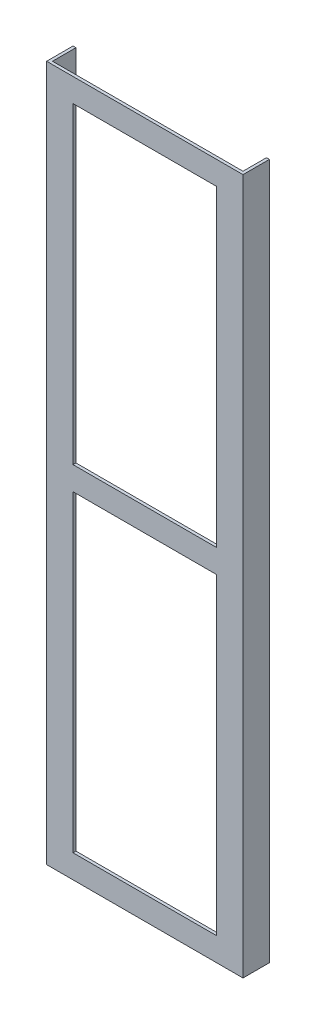
from build123d import *

# Parameters (mm, degrees)
SKETCH1_W                      = 103.175
SKETCH1_H                      = 103.175
SKETCH1_W_2                    = 100
SKETCH1_H_2                    = 100
BULKSHELLEXTRUDE_DEPTH         = 376.8
SKETCH14_W                     = 77.775
SKETCH14_H                     = 351.4
SIDEWALLCUT_DEPTH              = 103.1875
SIDEWALLCUTPATTERN_COUNT       = 4
SKETCH20_W                     = 77.775
SKETCH20_H                     = 12.7
CENTERSUPPORT_DEPTH            = 1.5875
CENTERSUPPORTPATTERNCIRC_COUNT = 4
SKETCH22_W                     = 100
SKETCH22_H                     = 376.8
CUT_EXTRUDE4_DEPTH             = 103.1875
SKETCH23_W                     = 1.5875
SKETCH23_H                     = 376.8
BOSS_EXTRUDE1_DEPTH            = 1.5875
SKETCH24_W                     = 1.5875
SKETCH24_H                     = 376.8
BOSS_EXTRUDE2_DEPTH            = 12.7


with BuildPart() as part:
    # Sketch1 → BulkShellExtrude (new body)
    with BuildSketch(Plane(origin=(0, 0, 0), x_dir=(1, 0, 0), z_dir=(0, 1, 0))):
        Rectangle(SKETCH1_W, SKETCH1_H)
        Rectangle(SKETCH1_W_2, SKETCH1_H_2, mode=Mode.SUBTRACT)
    extrude(amount=BULKSHELLEXTRUDE_DEPTH)

    # Sketch14 → SideWallCut (cut)
    with BuildSketch(Plane(origin=(51.5875, 0, 0), x_dir=(0, 0, -1), z_dir=(1, 0, 0))):
        with Locations((0, 188.4)):
            Rectangle(SKETCH14_W, SKETCH14_H)
    sidewallcut = extrude(amount=-SIDEWALLCUT_DEPTH, mode=Mode.SUBTRACT)

    # SideWallCutPattern: SideWallCut ×4 about axis
    sidewallcutpattern_axis = Axis((0, 0, 0), (0, 1, 0))
    for i in range(1, SIDEWALLCUTPATTERN_COUNT):
        add(sidewallcut.rotate(sidewallcutpattern_axis, i * 360 / SIDEWALLCUTPATTERN_COUNT), mode=Mode.SUBTRACT)

    # Sketch20 → CenterSupport (add)
    with BuildSketch(Plane.XY.offset(51.5875)):
        with Locations((0, 188.4)):
            Rectangle(SKETCH20_W, SKETCH20_H)
    centersupport = extrude(amount=-CENTERSUPPORT_DEPTH)

    # CenterSupportPatternCirc: CenterSupport ×4 about axis
    centersupportpatterncirc_axis = Axis((0, 0, 0), (0, 1, 0))
    for i in range(1, CENTERSUPPORTPATTERNCIRC_COUNT):
        add(centersupport.rotate(centersupportpatterncirc_axis, i * 360 / CENTERSUPPORTPATTERNCIRC_COUNT))

    # Sketch22 → Cut-Extrude4 (cut)
    with BuildSketch(Plane(origin=(51.5875, 0, 0), x_dir=(0, 0, -1), z_dir=(1, 0, 0))):
        with Locations((0, 188.4)):
            Rectangle(SKETCH22_W, SKETCH22_H)
    extrude(amount=-CUT_EXTRUDE4_DEPTH, mode=Mode.SUBTRACT)


with BuildPart() as body_2:
    # of the pieces the cut leaves, the one that is kept (cut_extrude4_keep)
    add(part.part.solids().sort_by_distance((51.5875, 0, 51.5875))[0])

    # Sketch23 → Boss-Extrude1 (add)
    with BuildSketch(Plane(origin=(51.5875, 0, 0), x_dir=(0, 0, -1), z_dir=(1, 0, 0))):
        with Locations((-50.79375, 188.4)):
            Rectangle(SKETCH23_W, SKETCH23_H)
    boss_extrude1 = extrude(amount=BOSS_EXTRUDE1_DEPTH)

    # Mirror1: Boss-Extrude1 across plane
    add(boss_extrude1.mirror(Plane(origin=(0, 0, 0), x_dir=(0, 0, 1), z_dir=(1, 0, 0))))

    # Sketch24 → Boss-Extrude2 (add)
    with BuildSketch(Plane(origin=(0, 0, 50), x_dir=(-1, 0, 0), z_dir=(0, 0, -1))):
        with Locations((-52.38125, 188.4)):
            Rectangle(SKETCH24_W, SKETCH24_H)
        with Locations((52.38125, 188.4)):
            Rectangle(SKETCH24_W, SKETCH24_H)
    extrude(amount=BOSS_EXTRUDE2_DEPTH)


solid = body_2.part
